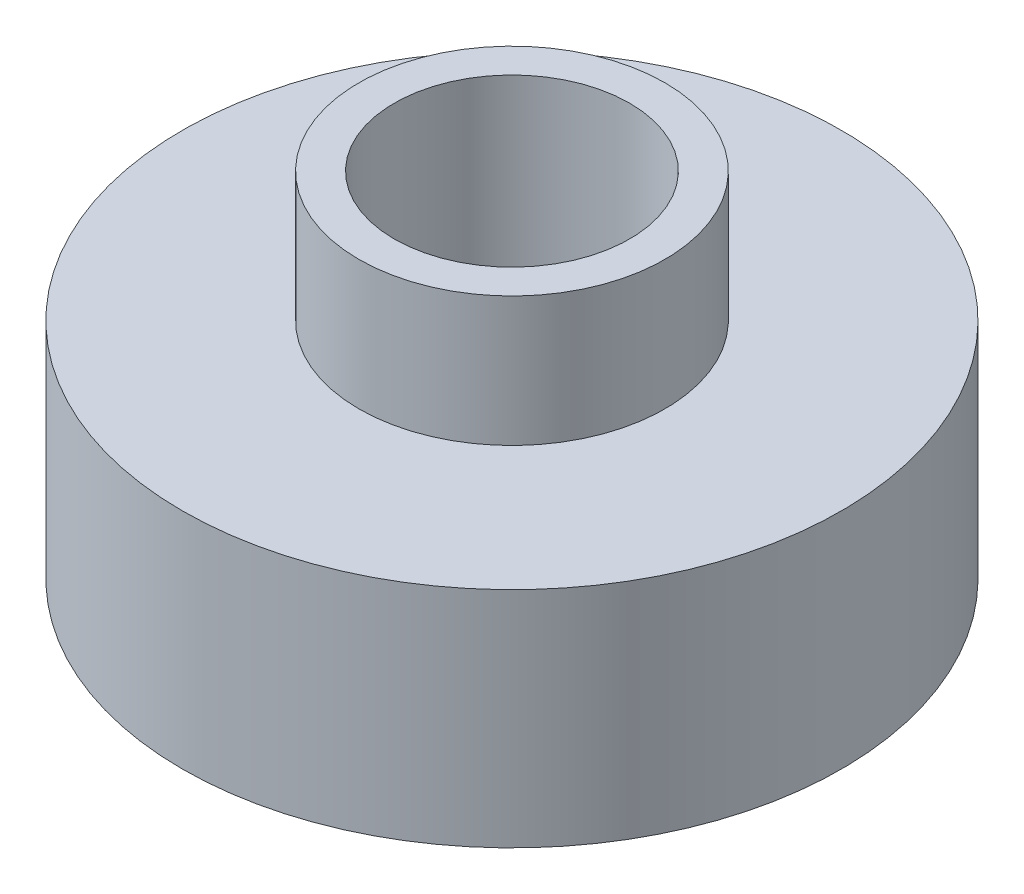
from build123d import *


with BuildPart() as part:
    # Sketch1 → Revolve1 (revolve)
    with BuildSketch(Plane.XY, mode=Mode.PRIVATE) as revolve1_sk:
        Polygon((56, 0), (48, 0), (48, 28), (20, 28), (20, 60), (26, 60), (26, 38), (56, 38), align=None)
    revolve(revolve1_sk.sketch.rotate(Axis((0, 93.493183641, 0), (0, -1, 0)), 90), axis=Axis((0, 93.493183641, 0), (0, -1, 0)))


solid = part.part
